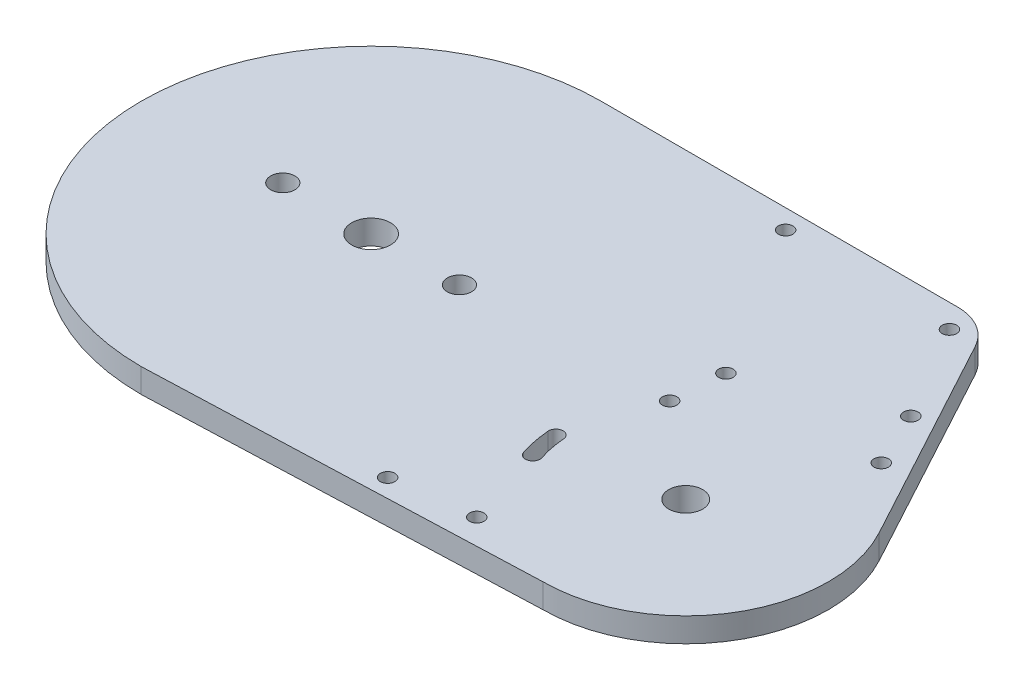
from build123d import *

# Parameters (mm, degrees)
SKETCH1_R           = 4
SKETCH1_R_2         = 1.5
SKETCH1_R_3         = 2.5
SKETCH1_R_4         = 3.5
BOSS_EXTRUDE1_DEPTH = 5


with BuildPart() as part:
    # Sketch1 → Boss-Extrude1 (new body)
    with BuildSketch(Plane(origin=(0, 0, 0), x_dir=(1, 0, 0), z_dir=(0, 1, 0))):
        with BuildLine():
            Line((0, -47.5), (80, -44.5))
            ThreePointArc((80, -44.5), (105.341650726, -30.101348895), (105.945295539, -0.961067014))
            Line((105.945295539, -0.961067014), (82.559049402, 42.258960334))
            ThreePointArc((82.559049402, 42.258960334), (78.883135286, 46.090390077), (73.764033965, 47.5))
            Line((73.764033965, 47.5), (0, 47.5))
            ThreePointArc((0, 47.5), (-47.5, 0), (0, -47.5))
        make_face()
        with Locations(Location((0, 0, 0), (0, 0, 270))):
            Circle(SKETCH1_R, mode=Mode.SUBTRACT)
        with Locations(Location((60.74263676, 0.942206906, 0), (0, 0, 270))):
            Circle(SKETCH1_R_2, mode=Mode.SUBTRACT)
        with Locations(Location((18.25, 0, 0), (0, 0, 270))):
            Circle(SKETCH1_R_3, mode=Mode.SUBTRACT)
        with Locations(Location((-18.25, 0, 0), (0, 0, 270))):
            Circle(SKETCH1_R_3, mode=Mode.SUBTRACT)
        with Locations(Location((80, -15, 0), (0, 0, 270))):
            Circle(SKETCH1_R_4, mode=Mode.SUBTRACT)
        with Locations(Location((76.835494757, 42.654234046, 0), (0, 0, 270))):
            Circle(SKETCH1_R_2, mode=Mode.SUBTRACT)
        with Locations(Location((88.354686129, 23.142870245, 0), (0, 0, 270))):
            Circle(SKETCH1_R_2, mode=Mode.SUBTRACT)
        with Locations(Location((42.137334928, 43.5, 0), (0, 0, 270))):
            Circle(SKETCH1_R_2, mode=Mode.SUBTRACT)
        with Locations(Location((45.293422434, -41.885064382, 0), (0, 0, 270))):
            Circle(SKETCH1_R_2, mode=Mode.SUBTRACT)
        with Locations(Location((61.591696316, 11.71100727, 0), (0, 0, 270))):
            Circle(SKETCH1_R_2, mode=Mode.SUBTRACT)
        with Locations(Location((93.688017257, 11.71100727, 0), (0, 0, 270))):
            Circle(SKETCH1_R_2, mode=Mode.SUBTRACT)
        with Locations(Location((61.591696316, -39.768646015, 0), (0, 0, 270))):
            Circle(SKETCH1_R_2, mode=Mode.SUBTRACT)
        with BuildLine():
            ThreePointArc((53.577406183, -17.023990113), (54.021018537, -20.229007757), (54.851917667, -23.356072939))
            ThreePointArc((54.851917667, -23.356072939), (56.748379286, -24.306564037), (57.698870384, -22.410102418))
            ThreePointArc((57.698870384, -22.410102418), (56.962035306, -19.637044615), (56.568643219, -16.794859157))
            ThreePointArc((56.568643219, -16.794859157), (54.958459223, -15.413806117), (53.577406183, -17.023990113))
        make_face(mode=Mode.SUBTRACT)
    extrude(amount=BOSS_EXTRUDE1_DEPTH)


solid = part.part
